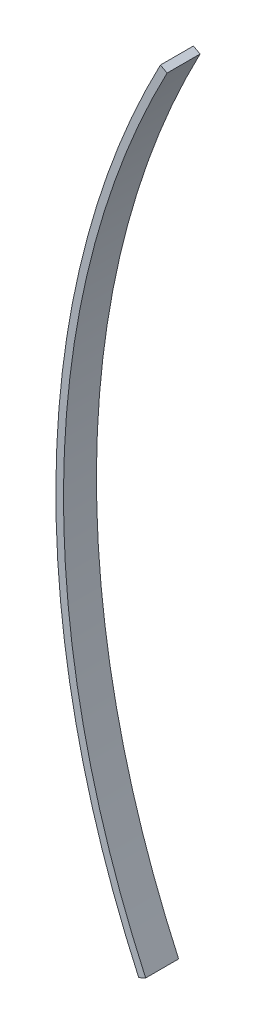
from build123d import *

# Parameters (mm, degrees)
EXTRUDE_THIN1_DEPTH = 6.5


with BuildPart() as part:
    # Sketch1 → Extrude-Thin1 (new body)
    with BuildSketch(Plane.XY):
        with BuildLine():
            ThreePointArc((9.423268045, 171.953020749), (-10.948701222, 94.114031818), (5.190265818, 15.288534214))
            Line((5.190265818, 15.288534214), (3.827391061, 14.661978235))
            ThreePointArc((3.827391061, 14.661978235), (-12.44815398, 94.15454634), (8.096215591, 172.652257322))
            Line((8.096215591, 172.652257322), (9.423268045, 171.953020749))
        make_face()
    extrude(amount=-EXTRUDE_THIN1_DEPTH)


solid = part.part
